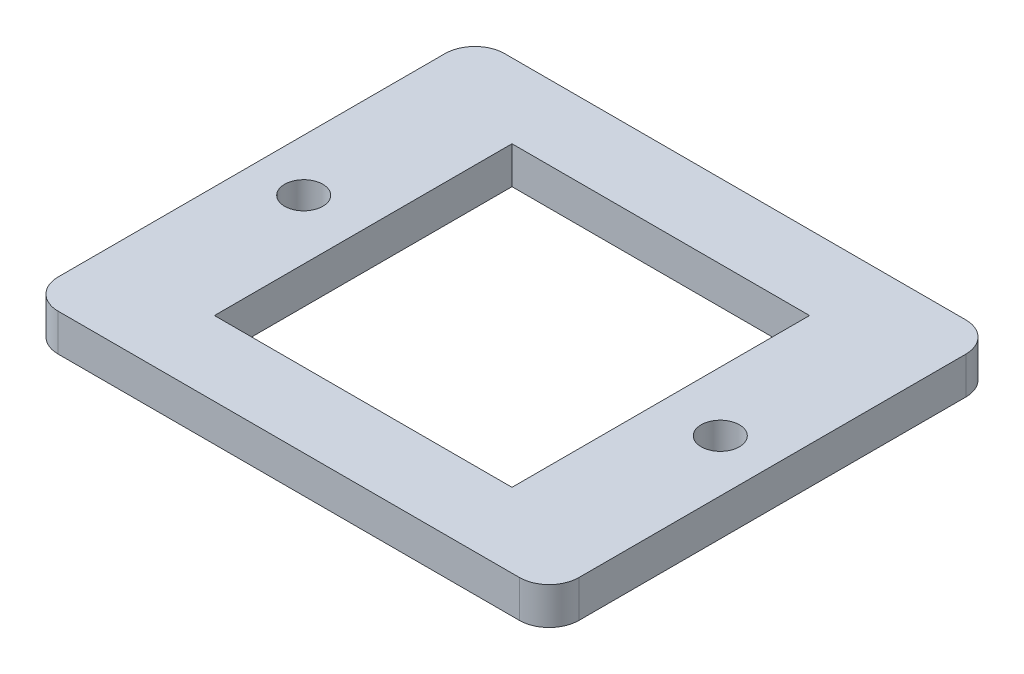
from build123d import *

# Parameters (mm, degrees)
SKETCH1_W                 = 44.45
SKETCH1_H                 = 38.1
BOSS_EXTRUDE1_DEPTH       = 3.175
SKETCH2_W                 = 25.4
SKETCH2_H                 = 25.4
CUT_EXTRUDE1_DEPTH        = 3.175
F_4_CLEARANCE_HOLE1_D     = 3.2639
F_4_CLEARANCE_HOLE1_DEPTH = 10.16
F_4_CLEARANCE_HOLE1_TIP   = 0.980574487
FILLET1_R                 = 2.54


with BuildPart() as part:
    # Sketch1 → Boss-Extrude1 (new body)
    with BuildSketch(Plane(origin=(0, 0, 0), x_dir=(1, 0, 0), z_dir=(0, 1, 0))):
        Rectangle(SKETCH1_W, SKETCH1_H)
    extrude(amount=BOSS_EXTRUDE1_DEPTH)

    # Sketch2 → Cut-Extrude1 (cut)
    with BuildSketch(Plane(origin=(0, 3.175, 0), x_dir=(1, 0, 0), z_dir=(0, 1, 0))):
        Rectangle(SKETCH2_W, SKETCH2_H)
    extrude(amount=-CUT_EXTRUDE1_DEPTH, mode=Mode.SUBTRACT)

    # #4 Clearance Hole1
    with Locations(Plane(origin=(0, 3.175, 0), x_dir=(1, 0, 0), z_dir=(0, 1, 0))):
        with Locations((-17.78, 0), (17.78, 0)):
            Hole(F_4_CLEARANCE_HOLE1_D / 2, depth=F_4_CLEARANCE_HOLE1_DEPTH)
            with Locations((0, 0, -(F_4_CLEARANCE_HOLE1_DEPTH + F_4_CLEARANCE_HOLE1_TIP / 2))):  # 118° drill point
                Cone(0, F_4_CLEARANCE_HOLE1_D / 2, F_4_CLEARANCE_HOLE1_TIP, mode=Mode.SUBTRACT)

    # Fillet1
    fillet1_edges = [part.edges().sort_by_distance(p)[0] for p in [
        (22.225, 1.5875, 19.05),
        (-22.225, 1.5875, 19.05),
        (-22.225, 1.5875, -19.05),
        (22.225, 1.5875, -19.05),
    ]]
    fillet(fillet1_edges, radius=FILLET1_R)


solid = part.part
